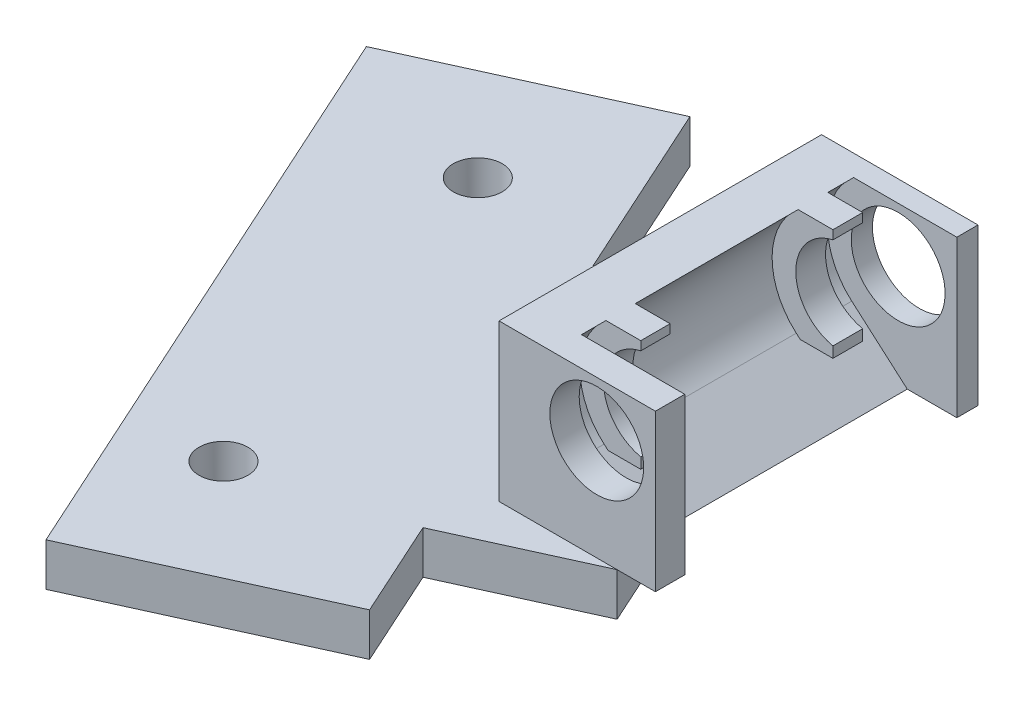
from build123d import *

# Parameters (mm, degrees)
BOSS_EXTRUDE1_DEPTH = 38.1
SKETCH5_W           = 20.32
SKETCH5_H           = 20.32
SKETCH5_R           = 6.096
BOSS_EXTRUDE2_DEPTH = 3.81
BOSS_EXTRUDE3_START = -2.75
SKETCH6_W           = 20.32
SKETCH6_H           = 20.32
SKETCH6_R           = 6.096
BOSS_EXTRUDE3_DEPTH = 2.75
SKETCH7_R           = 3.175
BOSS_EXTRUDE5_DEPTH = 5.5806
SKETCH9_W           = 3.861093931
SKETCH9_H           = 14.478
SKETCH9_W_2         = 3.81
BOSS_EXTRUDE6_DEPTH = 11.43
SKETCH10_R          = 6.096
CUT_EXTRUDE1_DEPTH  = 46.99


with BuildPart() as part:
    # Sketch2 → Boss-Extrude1 (new body)
    with BuildSketch(Plane.XY):
        with BuildLine():
            Line((-516.842314937, 117.112), (-516.842314937, 96.792))
            Line((-516.842314937, 96.792), (-502.961244289, 96.792))
            Line((-502.961244289, 96.792), (-510.174930628, 103.087100975))
            ThreePointArc((-510.174930628, 103.087100975), (-513.3160156, 110.15440578), (-509.938872623, 117.112))
            Line((-509.938872623, 117.112), (-516.842314937, 117.112))
        make_face()
    extrude(amount=-BOSS_EXTRUDE1_DEPTH)

    # Sketch5 → Boss-Extrude2 (add)
    with BuildSketch(Plane.XY):
        with Locations((-506.682314937, 106.952)):
            Rectangle(SKETCH5_W, SKETCH5_H)
        with Locations(Location((-504.142314937, 110, 0), (0, 0, 180))):
            Circle(SKETCH5_R, mode=Mode.SUBTRACT)
    extrude(amount=BOSS_EXTRUDE2_DEPTH)

    # Sketch6 → Boss-Extrude3 (add)
    with BuildSketch(Plane(origin=(0, 0, -38.1), x_dir=(-1, 0, 0), z_dir=(0, 0, -1)).offset(BOSS_EXTRUDE3_START)):
        with Locations((506.682314937, 106.952)):
            Rectangle(SKETCH6_W, SKETCH6_H)
        with Locations((504.142314937, 110)):
            Circle(SKETCH6_R, mode=Mode.SUBTRACT)
    extrude(amount=BOSS_EXTRUDE3_DEPTH)

    # Sketch7 → Boss-Extrude5 (add)
    with BuildSketch(Plane.XZ.offset(-96.792)):
        Polygon((-547.743463606, -51.896152362), (-576.647599265, -38.75790888), (-541.962636474, 37.549009261), (-513.058500814, 24.410765779), (-518.839327946, 11.692946089), (-501.496846551, 3.81), (-519.890387425, -36.655789923), (-537.232868821, -28.772843834), align=None)
        with Locations(Location((-554.645069674, -31.232511479, 0), (0, 0, 90))):
            Circle(SKETCH7_R, mode=Mode.SUBTRACT)
        with Locations(Location((-539.26913234, 17.184639935, 0), (0, 0, 90))):
            Circle(SKETCH7_R, mode=Mode.SUBTRACT)
    extrude(amount=BOSS_EXTRUDE5_DEPTH)

    # Sketch9 → Boss-Extrude6 (add)
    with BuildSketch(Plane.ZY.offset(516.842314937)):
        with Locations((-30.073453035, 109.873)):
            Rectangle(SKETCH9_W, SKETCH9_H)
        with Locations((-5.08, 109.873)):
            Rectangle(SKETCH9_W_2, SKETCH9_H)
    extrude(amount=-BOSS_EXTRUDE6_DEPTH)

    # Sketch10 → Cut-Extrude1 (cut)
    with BuildSketch(Plane.XY.offset(3.81)):
        with Locations(Location((-504.142314937, 110, 0), (0, 0, 180))):
            Circle(SKETCH10_R)
    extrude(amount=-CUT_EXTRUDE1_DEPTH, mode=Mode.SUBTRACT)


solid = part.part
